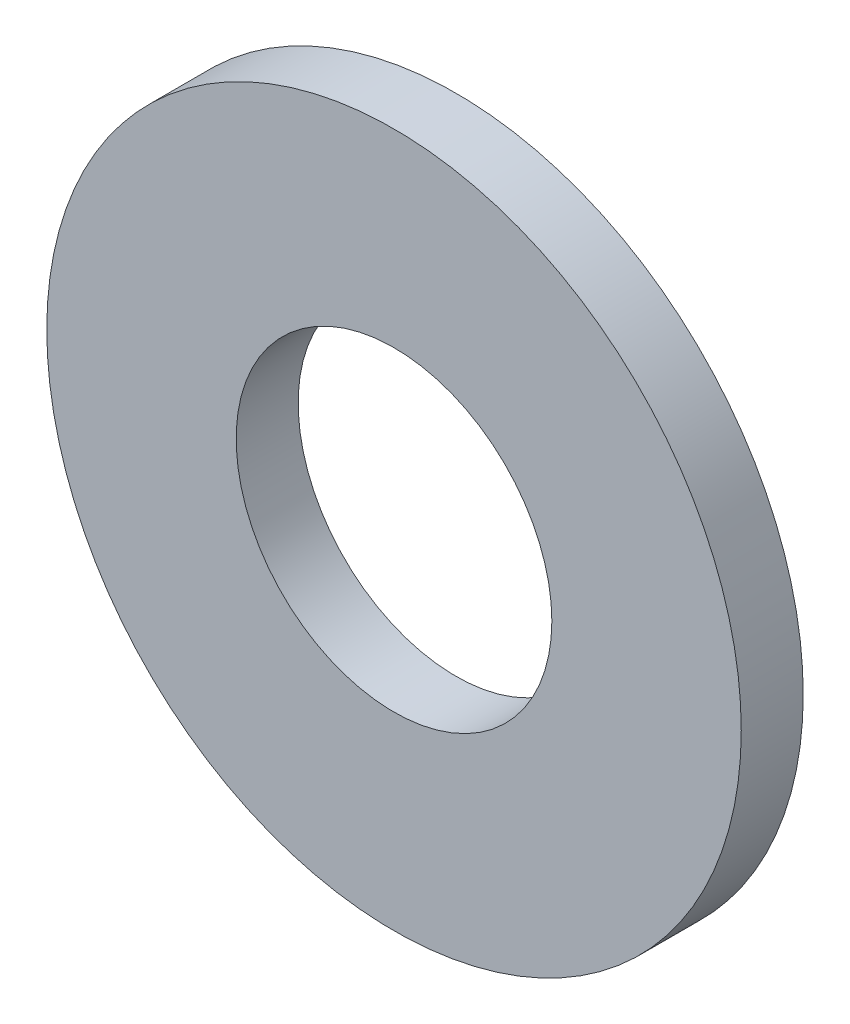
from build123d import *

# Parameters (mm, degrees)
SKETCH1_R           = 26.543
SKETCH1_R_2         = 12.065
BOSS_EXTRUDE1_DEPTH = 4.7371


with BuildPart() as part:
    # Sketch1 → Boss-Extrude1 (new body)
    with BuildSketch(Plane.XY):
        Circle(SKETCH1_R)
        Circle(SKETCH1_R_2, mode=Mode.SUBTRACT)
    extrude(amount=BOSS_EXTRUDE1_DEPTH)


solid = part.part
